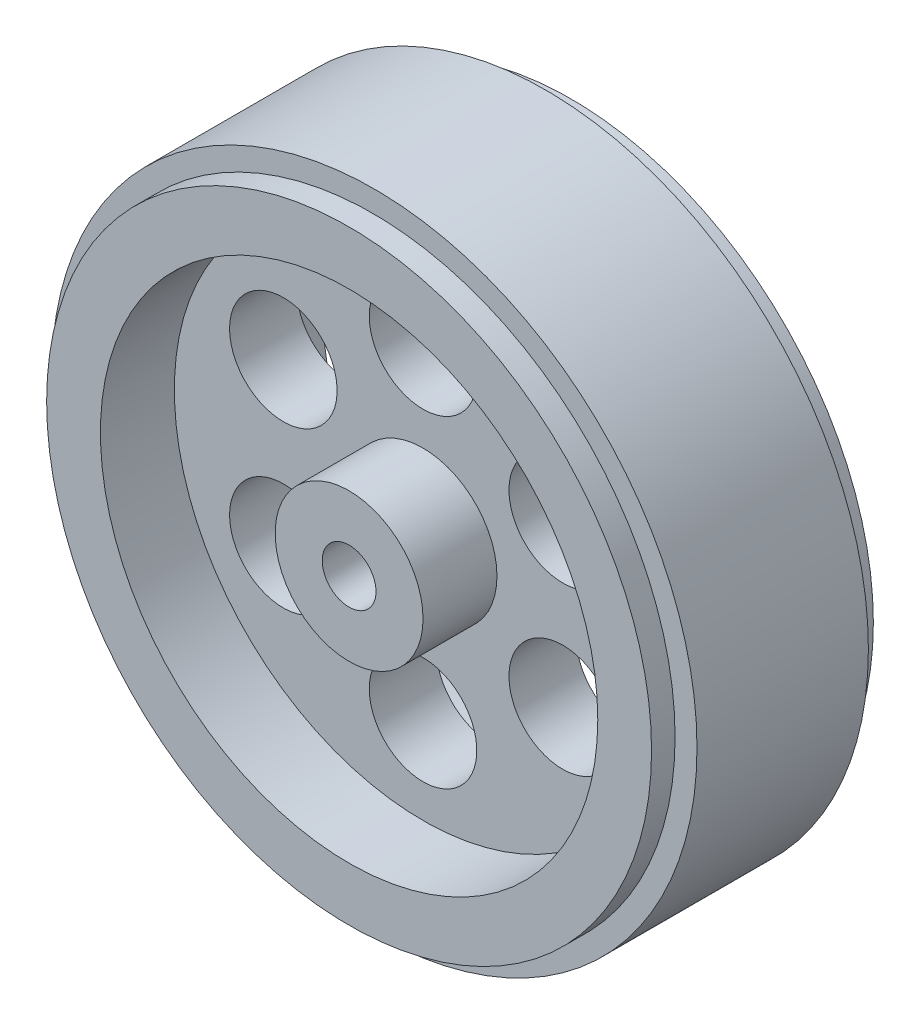
from build123d import *

# Parameters (mm, degrees)
SKETCH1_W          = 25.5
SKETCH1_H          = 6
SKETCH2_R          = 8
CUT_EXTRUDE1_DEPTH = 72.069826227


with BuildPart() as part:
    # Sketch1 → Revolve1 (revolve)
    with BuildSketch(Plane(origin=(0, 0, 0), x_dir=(0, 0, -1), z_dir=(1, 0, 0)), mode=Mode.PRIVATE) as revolve1_sk:
        Polygon((13, 42), (-13, 42), (-13, 45), (-16.5, 45), (-16.5, 37), (-5.5, 37), (-5.5, 11), (-16.5, 11), (-16.5, 4), (4.5, 4), (4.5, 37), (16.5, 37), (16.5, 45), (13, 45), align=None)
        with Locations((0, 45.01)):
            Rectangle(SKETCH1_W, SKETCH1_H)
    revolve(revolve1_sk.sketch.rotate(Axis((0, 0, 177.272954683), (0, 0, -1)), 90), axis=Axis((0, 0, 177.272954683), (0, 0, -1)))

    # Sketch2 → Cut-Extrude1 (cut, through all)
    with BuildSketch(Plane(origin=(0, 0, -4.5), x_dir=(-1, 0, 0), z_dir=(0, 0, -1))):
        with Locations((0, 24)):
            Circle(SKETCH2_R)
        with Locations((20.784609691, 12)):
            Circle(SKETCH2_R)
        with Locations((20.784609691, -12)):
            Circle(SKETCH2_R)
        with Locations((0, -24)):
            Circle(SKETCH2_R)
        with Locations((-20.784609691, -12)):
            Circle(SKETCH2_R)
        with Locations((-20.784609691, 12)):
            Circle(SKETCH2_R)
    extrude(amount=-CUT_EXTRUDE1_DEPTH, mode=Mode.SUBTRACT)


solid = part.part
